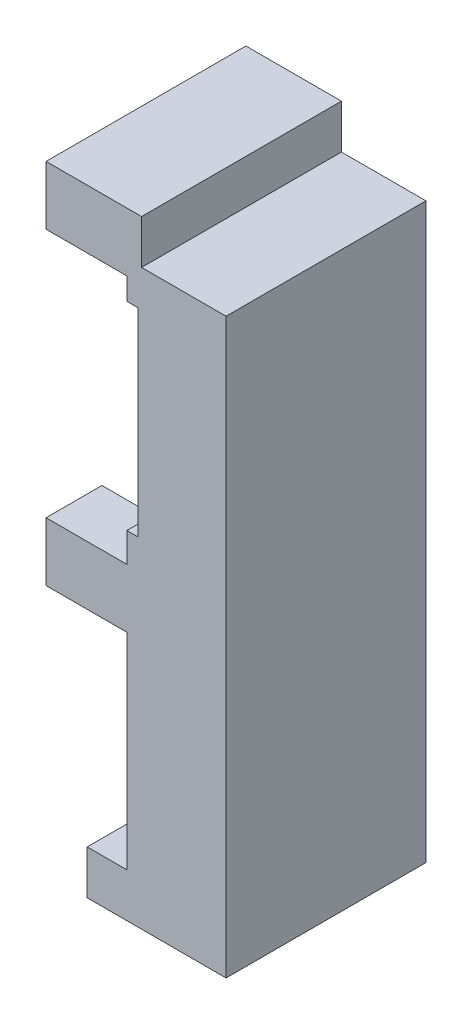
from build123d import *

# Parameters (mm, degrees)
GUIDE_AND_SOLID_STOPS_DEPTH  = 13.6
SKETCH_3_W                   = 8.4
SKETCH_3_H                   = 14
NUT_TONGUE_CHANNEL_DEPTH     = 2.8
SKETCH_4_W                   = 6.25
SKETCH_4_H                   = 5.2
LOWER_YOKE_RELIEF_DEPTH      = 3
SKETCH_5_W                   = 3.7
SKETCH_5_H                   = 3
LOWER_INWARD_STOP_DEPTH      = 3.8
SKETCH_7_W                   = 3.7
SKETCH_7_H                   = 3
EXTRUDE_2_DEPTH              = 3.8
REMOVE_LOWER_TAIL_DEPTH      = 62.002151601
REMOVE_LOWER_TAIL_DEPTH_BACK = 62.002151601
SKETCH_8_W                   = 17
SKETCH_8_H                   = 17


with BuildPart() as part:
    # 草图1 → Guide_and_solid_stops (new body)
    with BuildSketch(Plane.XY):
        Polygon((10.2, 0), (16.95, 0), (16.95, 54), (11.2, 54), (11.2, 57), (4.7, 57), (4.7, 53), (10.2, 53), (10.2, 51.5), (10.95, 51.5), (10.95, 38), (10.2, 38), (10.2, 36), (4.7, 36), (4.7, 32), (10.2, 32), align=None)
    extrude(amount=GUIDE_AND_SOLID_STOPS_DEPTH)

    # 草图3 → Nut_tongue_channel (cut, symmetric)
    with BuildSketch(Plane.XY.offset(6.8)):
        with Locations((11.2, 44.5)):
            Rectangle(SKETCH_3_W, SKETCH_3_H)
    extrude(amount=NUT_TONGUE_CHANNEL_DEPTH, both=True, mode=Mode.SUBTRACT)

    # 草图4 → Lower_yoke_relief (cut, symmetric)
    with BuildSketch(Plane.XY.offset(6.8)):
        with Locations((7.125, 33.6)):
            Rectangle(SKETCH_4_W, SKETCH_4_H)
    extrude(amount=LOWER_YOKE_RELIEF_DEPTH, both=True, mode=Mode.SUBTRACT)

    # 草图5 → Lower_inward_stop (add)
    with BuildSketch(Plane.XY):
        with Locations((9.35, 16.5)):
            Rectangle(SKETCH_5_W, SKETCH_5_H)
    extrude(amount=LOWER_INWARD_STOP_DEPTH)

    # 草图7 → 凸台-拉伸2 (add)
    with BuildSketch(Plane.XY.offset(9.8)):
        with Locations((9.35, 16.5)):
            Rectangle(SKETCH_7_W, SKETCH_7_H)
    extrude(amount=EXTRUDE_2_DEPTH)

    # 草图8 → Remove_lower_tail (cut, two sides: drawn at the far end of the back side and taken through both)
    with BuildSketch(Plane.XY.offset(-REMOVE_LOWER_TAIL_DEPTH_BACK)):
        with Locations((11.5, 6.5)):
            Rectangle(SKETCH_8_W, SKETCH_8_H)
    extrude(amount=REMOVE_LOWER_TAIL_DEPTH + REMOVE_LOWER_TAIL_DEPTH_BACK, mode=Mode.SUBTRACT)


solid = part.part
